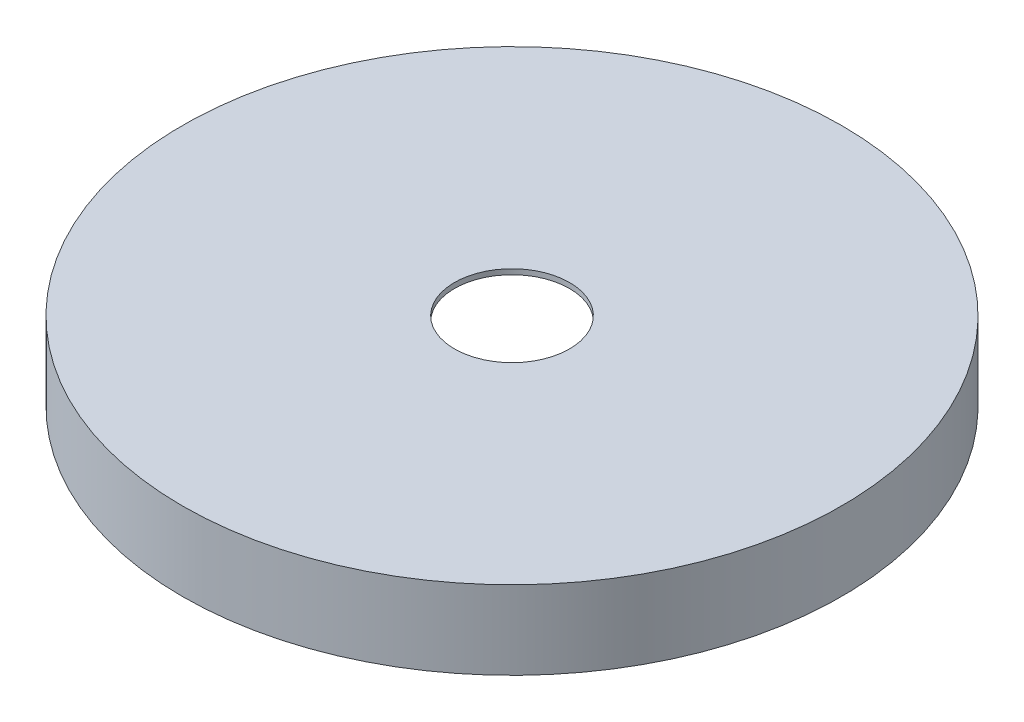
from build123d import *


with BuildPart() as part:
    # Sketch1 → Revolve1 (revolve)
    with BuildSketch(Plane.XY, mode=Mode.PRIVATE) as revolve1_sk:
        Polygon((-160.02, 0), (-160.02, 38.1), (-27.94, 38.1), (-27.94, 35.56), (-157.48, 35.56), (-157.48, 0), align=None)
    revolve(revolve1_sk.sketch.rotate(Axis((0, -2.54, 0), (0, 1, 0)), 270), axis=Axis((0, -2.54, 0), (0, 1, 0)))


solid = part.part
